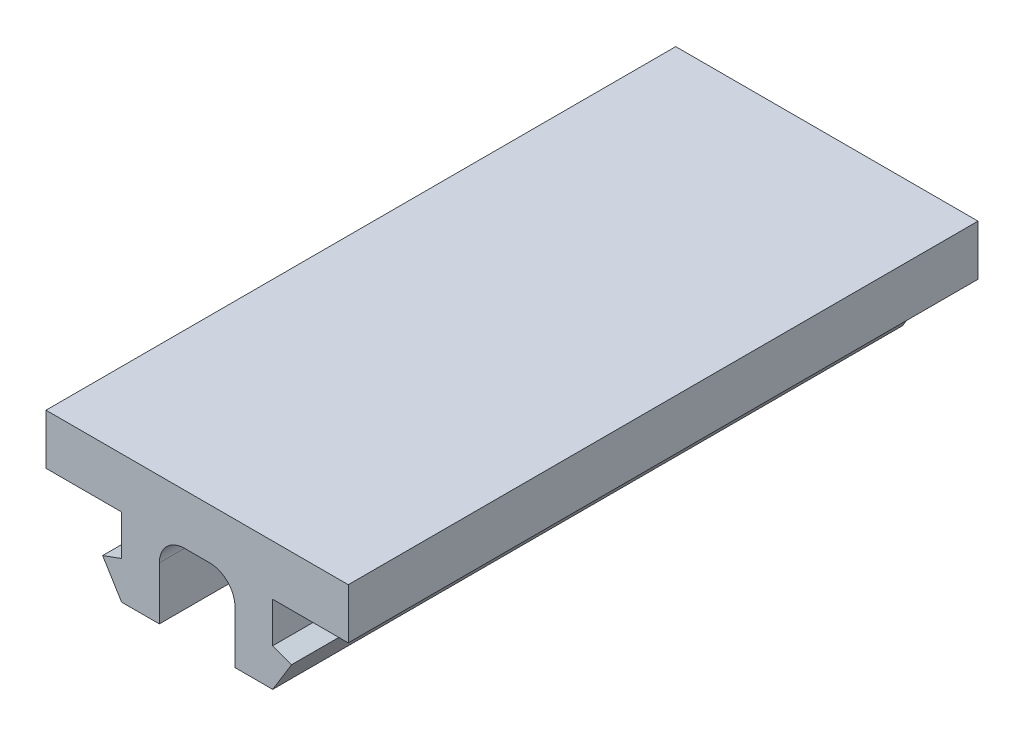
from build123d import *

# Parameters (mm, degrees)
BOSS_EXTRUDE1_DEPTH = 25


with BuildPart() as part:
    # Sketch1 → Boss-Extrude1 (new body)
    with BuildSketch(Plane.XY):
        with BuildLine():
            Line((0, 0), (12, 0))
            Line((12, 0), (12, -2))
            Line((12, -2), (9, -2))
            Line((9, -2), (9, -3.6))
            Line((9, -3.6), (9.751754097, -3.873616115))
            Line((9.751754097, -3.873616115), (9, -5.1))
            Line((9, -5.1), (7.5, -5.1))
            Line((7.5, -5.1), (7.5, -3))
            ThreePointArc((7.5, -3), (7.207106781, -2.292893219), (6.5, -2))
            Line((6.5, -2), (5.5, -2))
            ThreePointArc((5.5, -2), (4.792893219, -2.292893219), (4.5, -3))
            Line((4.5, -3), (4.5, -5.1))
            Line((4.5, -5.1), (3, -5.1))
            Line((3, -5.1), (2.248245903, -3.873616115))
            Line((2.248245903, -3.873616115), (3, -3.6))
            Line((3, -3.6), (3, -2))
            Line((3, -2), (0, -2))
            Line((0, -2), (0, 0))
        make_face()
    extrude(amount=BOSS_EXTRUDE1_DEPTH)


solid = part.part
